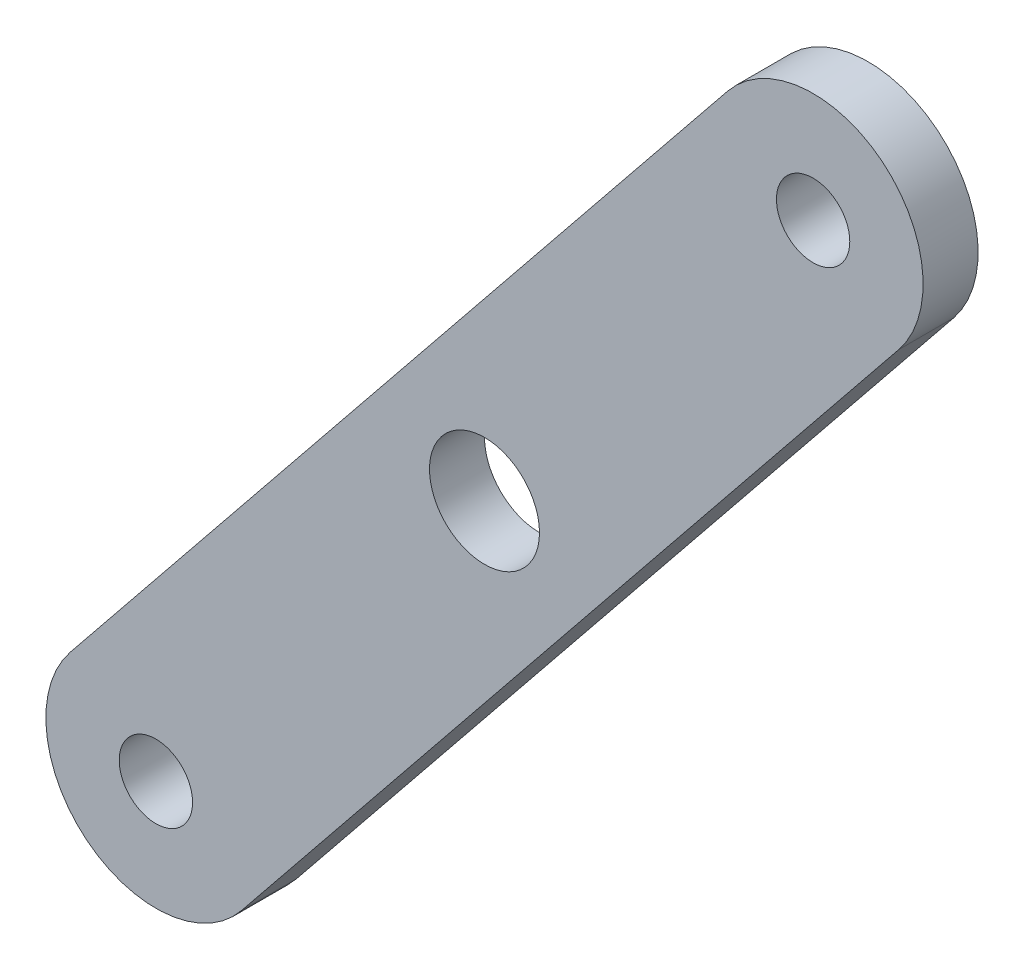
from build123d import *

# Parameters (mm, degrees)
SKETCH_1_R      = 1
SKETCH_1_R_2    = 1.5
EXTRUDE_1_DEPTH = 1.5


with BuildPart() as part:
    # 草图1 → 凸台-拉伸1 (new body)
    with BuildSketch(Plane.XY):
        with BuildLine():
            Line((8.565353329, -6.873354049), (26.488953147, 15.336467418))
            ThreePointArc((26.488953147, 15.336467418), (30.707602897, 15.787016295), (31.158151773, 11.568366545))
            Line((31.158151773, 11.568366545), (13.234551956, -10.641454921))
            ThreePointArc((13.234551956, -10.641454921), (9.015902206, -11.092003798), (8.565353329, -6.873354049))
        make_face()
        with Locations((28.82355246, 13.452416982)):
            Circle(SKETCH_1_R, mode=Mode.SUBTRACT)
        with Locations((10.899952643, -8.757404485)):
            Circle(SKETCH_1_R, mode=Mode.SUBTRACT)
        with Locations((19.861752551, 2.347506248)):
            Circle(SKETCH_1_R_2, mode=Mode.SUBTRACT)
    extrude(amount=EXTRUDE_1_DEPTH)


solid = part.part
